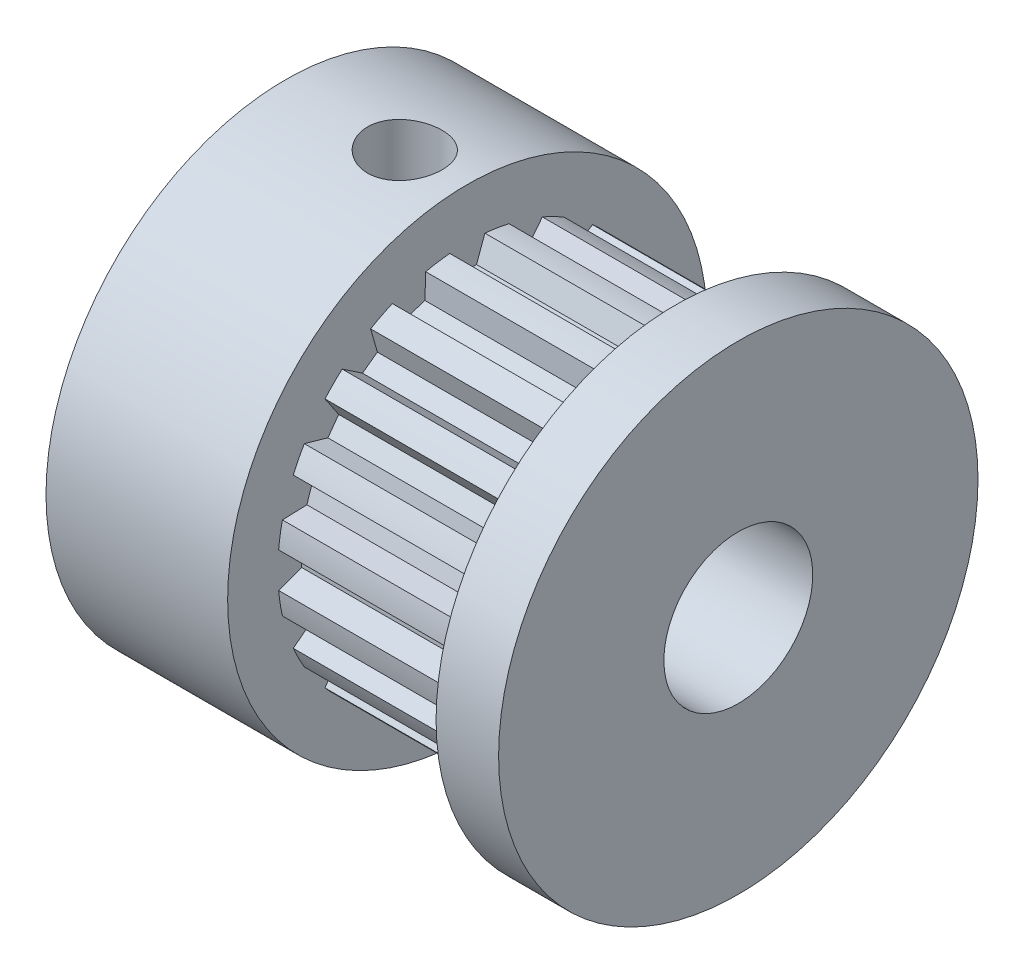
from build123d import *

# Parameters (mm, degrees)
M3_TAPPED_HOLE1_REACH  = 23.2
M3_TAPPED_HOLE1_BORE_R = 1.25
CUT_EXTRUDE1_DEPTH     = 7
CIRPATTERN1_COUNT      = 20


with BuildPart() as part:
    # Sketch1 → Revolve1 (revolve)
    with BuildSketch(Plane.XY, mode=Mode.PRIVATE) as revolve1_sk:
        Polygon((0, 2.5), (15.2, 2.5), (15.2, 8.05), (13.1, 8.05), (13.1, 6.365), (6.1, 6.365), (6.1, 8.05), (0, 8.05), align=None)
    revolve(revolve1_sk.sketch.rotate(Axis((0, 0, 0), (1, 0, 0)), 90), axis=Axis((0, 0, 0), (1, 0, 0)))

    # M3 Tapped Hole1 bore (on position points) → M3 Tapped Hole1 (cut, up to next)
    with BuildSketch(Plane(origin=(4, 8.05, 0), x_dir=(0, 0, 1), z_dir=(0, 1, 0)), mode=Mode.PRIVATE) as m3_tapped_hole1_sk1:
        Circle(M3_TAPPED_HOLE1_BORE_R)
    m3_tapped_hole1_tool1 = extrude(m3_tapped_hole1_sk1.sketch, amount=-M3_TAPPED_HOLE1_REACH, mode=Mode.PRIVATE) & part.part
    add(m3_tapped_hole1_tool1.solids().sort_by_distance((4, 8.05, 0))[0], mode=Mode.SUBTRACT)

    # Sketch3 → Cut-Extrude1 (cut)
    with BuildSketch(Plane.ZY.offset(-13.1)):
        Polygon((-0.6, 6.365), (-0.308823813, 5.565), (0.308823813, 5.565), (0.6, 6.365), align=None)
    cut_extrude1 = extrude(amount=CUT_EXTRUDE1_DEPTH, mode=Mode.SUBTRACT)

    # CirPattern1: Cut-Extrude1 ×20 about axis
    cirpattern1_axis = Axis((0, 0, 0), (1, 0, 0))
    for i in range(1, CIRPATTERN1_COUNT):
        add(cut_extrude1.rotate(cirpattern1_axis, i * 360 / CIRPATTERN1_COUNT), mode=Mode.SUBTRACT)


solid = part.part
